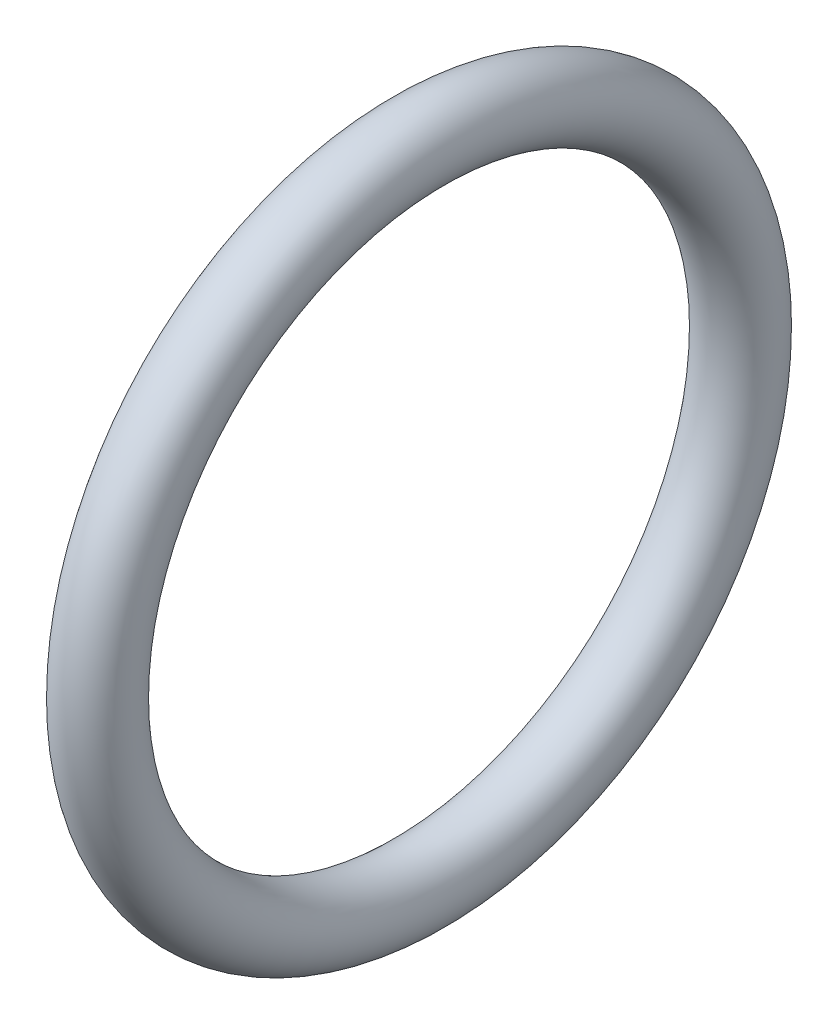
from build123d import *

# Parameters (mm, degrees)
SKETCH_1_R = 1.6


with BuildPart() as part:
    # 草图1 → 旋转1 (revolve)
    with BuildSketch(Plane.XY, mode=Mode.PRIVATE) as revolve_1_sk:
        with Locations((0, 14.25)):
            Circle(SKETCH_1_R)
    revolve(revolve_1_sk.sketch.rotate(Axis((0, 0, 0), (1, 0, 0)), 90), axis=Axis((0, 0, 0), (1, 0, 0)))


solid = part.part
